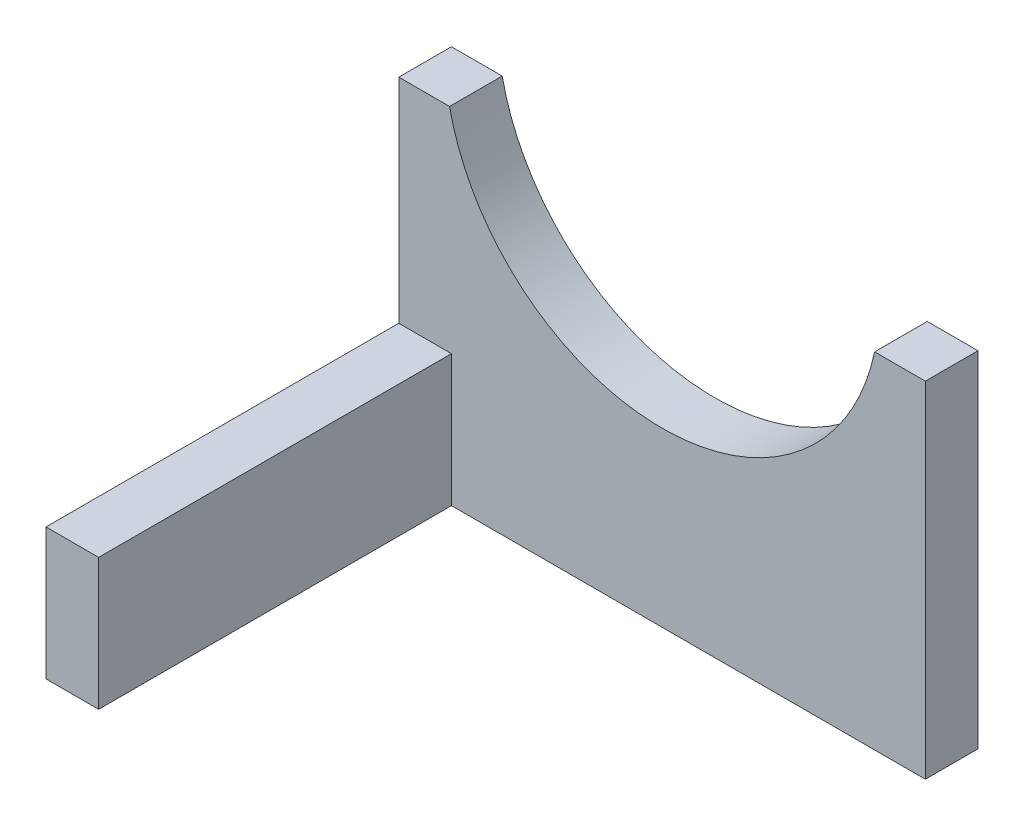
from build123d import *

# Parameters (mm, degrees)
BOSS_EXTRUDE1_DEPTH = 5.08
SKETCH2_W           = 34.036
SKETCH2_H           = 12.7
BOSS_EXTRUDE2_DEPTH = 5.08


with BuildPart() as part:
    # Sketch1 → Boss-Extrude1 (new body)
    with BuildSketch(Plane.XY):
        with BuildLine():
            ThreePointArc((4.89576896, 33.263952472), (25.4, 16.631976236), (45.90423104, 33.263952472))
            Line((45.90423104, 33.263952472), (50.8, 33.263952472))
            Line((50.8, 33.263952472), (50.8, 0))
            Line((50.8, 0), (0, 0))
            Line((0, 0), (0, 33.263952472))
            Line((0, 33.263952472), (4.89576896, 33.263952472))
        make_face()
    extrude(amount=BOSS_EXTRUDE1_DEPTH)

    # Sketch2 → Boss-Extrude2 (add)
    with BuildSketch(Plane(origin=(0, 0, 0), x_dir=(0, 0, -1), z_dir=(1, 0, 0))):
        with Locations((-22.098, 6.35)):
            Rectangle(SKETCH2_W, SKETCH2_H)
    extrude(amount=BOSS_EXTRUDE2_DEPTH)


solid = part.part
